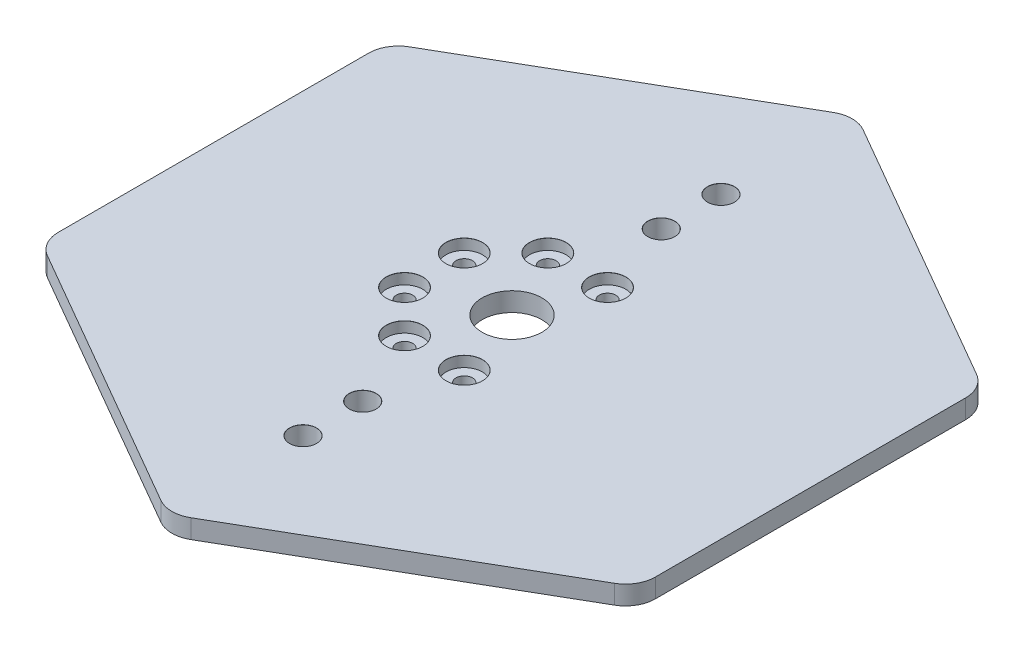
from build123d import *

# Parameters (mm, degrees)
BOSS_EXTRUDE1_DEPTH                    = 6.35
SKETCH2_R                              = 10
CUT_EXTRUDE1_DEPTH                     = 153.884452556
M8_CLEARANCE_HOLE1_D                   = 9
M8_CLEARANCE_HOLE1_CSINK_D             = 9.05
M8_CLEARANCE_HOLE1_CSINK_ANGLE         = 90
CBORE_FOR_M5_HEX_HEAD_BOLT1_AT_2_COUNT = 2
CBORE_FOR_M5_HEX_HEAD_BOLT1_AT_2_PITCH = 19.798989873
CBORE_FOR_M5_HEX_HEAD_BOLT1_AT_3_COUNT = 2
CBORE_FOR_M5_HEX_HEAD_BOLT1_AT_3_PITCH = 36.769552622
CBORE_FOR_M5_HEX_HEAD_BOLT1_AT_4_COUNT = 2
CBORE_FOR_M5_HEX_HEAD_BOLT1_AT_4_PITCH = 20
CBORE_FOR_M5_HEX_HEAD_BOLT1_AT_5_COUNT = 2
CBORE_FOR_M5_HEX_HEAD_BOLT1_AT_5_PITCH = 36.769552622
CBORE_FOR_M5_HEX_HEAD_BOLT1_AT_6_COUNT = 2
CBORE_FOR_M5_HEX_HEAD_BOLT1_AT_6_PITCH = 48.083261121
FILLET1_R                              = 10


with BuildPart() as part:
    # Sketch1 → Boss-Extrude1 (new body)
    with BuildSketch(Plane(origin=(0, 0, 0), x_dir=(1, 0, 0), z_dir=(0, 1, 0))):
        Polygon((100, 57.735026919), (0, 115.470053838), (-100, 57.735026919), (-100, -57.735026919), (0, -115.470053838), (100, -57.735026919), align=None)
    extrude(amount=BOSS_EXTRUDE1_DEPTH)

    # Sketch2 → Cut-Extrude1 (cut, through all)
    with BuildSketch(Plane(origin=(0, 6.35, 0), x_dir=(1, 0, 0), z_dir=(0, 1, 0))):
        with Locations(Location((0, 0, 0), (0, 0, 270))):
            Circle(SKETCH2_R)
    extrude(amount=-CUT_EXTRUDE1_DEPTH, mode=Mode.SUBTRACT)

    # M8 Clearance Hole1 (through all)
    with Locations(Plane(origin=(0, 6.35, 0), x_dir=(1, 0, 0), z_dir=(0, 1, 0))):
        with Locations((0, 70), (0, 50), (0, -50), (0, -70)):
            CounterSinkHole(M8_CLEARANCE_HOLE1_D / 2, M8_CLEARANCE_HOLE1_CSINK_D / 2, counter_sink_angle=M8_CLEARANCE_HOLE1_CSINK_ANGLE)

    # Sketch8 → CBORE for M5 Hex Head Bolt1 (revolve, cut)
    with BuildSketch(Plane(origin=(-26, 6.35, -10), x_dir=(0, 0, 1), z_dir=(1, 0, 0))):
        Polygon((0, 0), (0, 6.35), (2.75, 6.35), (2.75, 3.58), (6.12, 3.58), (6.12, 0.025), (6.145, 0), align=None)
    cbore_for_m5_hex_head_bolt1 = revolve(axis=Axis((-26, 12.7, -10), (0, -1, 0)), mode=Mode.SUBTRACT)

    # CBORE for M5 Hex Head Bolt1 at 2: CBORE for M5 Hex Head Bolt1 ×2
    with Locations(*[Vector(0.7071067811865476, 0, -0.7071067811865476) * (i * CBORE_FOR_M5_HEX_HEAD_BOLT1_AT_2_PITCH) for i in range(1, CBORE_FOR_M5_HEX_HEAD_BOLT1_AT_2_COUNT)]):
        add(cbore_for_m5_hex_head_bolt1, mode=Mode.SUBTRACT)

    # CBORE for M5 Hex Head Bolt1 at 3: CBORE for M5 Hex Head Bolt1 ×2
    with Locations(*[Vector(0.924678098474716, 0, -0.38074980525429486) * (i * CBORE_FOR_M5_HEX_HEAD_BOLT1_AT_3_PITCH) for i in range(1, CBORE_FOR_M5_HEX_HEAD_BOLT1_AT_3_COUNT)]):
        add(cbore_for_m5_hex_head_bolt1, mode=Mode.SUBTRACT)

    # CBORE for M5 Hex Head Bolt1 at 4: CBORE for M5 Hex Head Bolt1 ×2
    with Locations(*[(0, 0, i * CBORE_FOR_M5_HEX_HEAD_BOLT1_AT_4_PITCH) for i in range(1, CBORE_FOR_M5_HEX_HEAD_BOLT1_AT_4_COUNT)]):
        add(cbore_for_m5_hex_head_bolt1, mode=Mode.SUBTRACT)

    # CBORE for M5 Hex Head Bolt1 at 5: CBORE for M5 Hex Head Bolt1 ×2
    with Locations(*[Vector(0.38074980525429486, 0, 0.924678098474716) * (i * CBORE_FOR_M5_HEX_HEAD_BOLT1_AT_5_PITCH) for i in range(1, CBORE_FOR_M5_HEX_HEAD_BOLT1_AT_5_COUNT)]):
        add(cbore_for_m5_hex_head_bolt1, mode=Mode.SUBTRACT)

    # CBORE for M5 Hex Head Bolt1 at 6: CBORE for M5 Hex Head Bolt1 ×2
    with Locations(*[Vector(0.7071067811865476, 0, 0.7071067811865476) * (i * CBORE_FOR_M5_HEX_HEAD_BOLT1_AT_6_PITCH) for i in range(1, CBORE_FOR_M5_HEX_HEAD_BOLT1_AT_6_COUNT)]):
        add(cbore_for_m5_hex_head_bolt1, mode=Mode.SUBTRACT)

    # Fillet1
    fillet1_edges = [part.edges().sort_by_distance(p)[0] for p in [
        (100, 3.175, 57.735026919),
        (0, 3.175, 115.470053838),
        (-100, 3.175, 57.735026919),
        (-100, 3.175, -57.735026919),
        (0, 3.175, -115.470053838),
        (100, 3.175, -57.735026919),
    ]]
    fillet(fillet1_edges, radius=FILLET1_R)


solid = part.part
